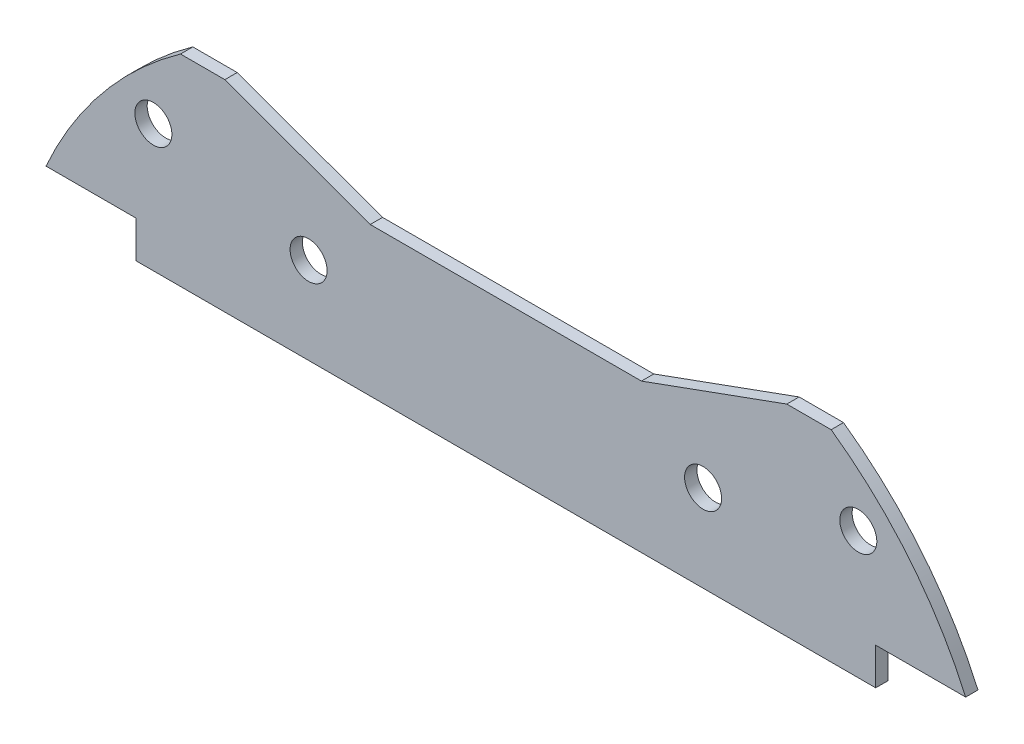
from build123d import *

# Parameters (mm, degrees)
BOSS_EXTRUDE1_DEPTH = 3
SKETCH2_R           = 1.5
CUT_EXTRUDE3_DEPTH  = 3
CUT_EXTRUDE4_START  = -10
CUT_EXTRUDE4_DEPTH  = 10
BOSS_EXTRUDE2_START = -3
BOSS_EXTRUDE2_DEPTH = 3
SKETCH5_W           = 0.56
SKETCH5_H           = 32.898596714
CUT_EXTRUDE5_DEPTH  = 3
SKETCH6_W           = 0.2
SKETCH6_H           = 32.898596714
CUT_EXTRUDE6_DEPTH  = 3
SKETCH7_R           = 2
CUT_EXTRUDE8_DEPTH  = 3
BOSS_EXTRUDE3_START = -3
BOSS_EXTRUDE3_DEPTH = 3
CUT_EXTRUDE9_START  = -3
CUT_EXTRUDE9_DEPTH  = 3
BOSS_EXTRUDE5_START = -3
BOSS_EXTRUDE5_DEPTH = 3
CUT_EXTRUDE10_START = -2
CUT_EXTRUDE10_DEPTH = 2
CUT_EXTRUDE11_START = -3
CUT_EXTRUDE11_DEPTH = 3
SKETCH13_R          = 1.5
CUT_EXTRUDE12_DEPTH = 1
SKETCH15_R          = 1.5
CUT_EXTRUDE13_DEPTH = 10


with BuildPart() as part:
    # Sketch1 → Boss-Extrude1 (new body)
    with BuildSketch(Plane.XY):
        with BuildLine():
            Line((-11, 25.5), (-22.790038711, 29.780264196))
            ThreePointArc((-22.790038711, 29.780264196), (0, -37.5), (22.790038711, 29.780264196))
            Line((22.790038711, 29.780264196), (11, 25.5))
            Line((11, 25.5), (-11, 25.5))
        make_face()
    extrude(amount=BOSS_EXTRUDE1_DEPTH)

    # Sketch2 → Cut-Extrude3 (cut)
    with BuildSketch(Plane.XY.offset(3)):
        with Locations((-25.400000001, 10.496905453)):
            Circle(SKETCH2_R)
        with Locations((-25.399981845, -10.493094547)):
            Circle(SKETCH2_R)
        with Locations(Location((25.399981845, -10.493094547, 0), (0, 0, 180))):
            Circle(SKETCH2_R)
        with Locations(Location((25.400000001, 10.496905453, 0), (0, 0, 180))):
            Circle(SKETCH2_R)
    extrude(amount=-CUT_EXTRUDE3_DEPTH, mode=Mode.SUBTRACT)

    # Sketch3 → Cut-Extrude4 (cut)
    with BuildSketch(Plane.XY.offset(3).offset(CUT_EXTRUDE4_START)):
        with BuildLine():
            Line((-30.76, 21.449298357), (-30.76, -21.449298357))
            ThreePointArc((-30.76, -21.449298357), (-37.5, 0), (-30.76, 21.449298357))
        make_face()
        with BuildLine():
            Line((30.76, 21.449298357), (30.76, -21.449298357))
            ThreePointArc((30.76, -21.449298357), (37.5, 0), (30.76, 21.449298357))
        make_face()
    extrude(amount=CUT_EXTRUDE4_DEPTH, mode=Mode.SUBTRACT)

    # Sketch4 → Boss-Extrude2 (add)
    with BuildSketch(Plane.XY.offset(3).offset(BOSS_EXTRUDE2_START)):
        with BuildLine():
            Line((-30.76, -21.449298357), (-30.76, -16.449298357))
            Line((-30.76, -16.449298357), (-33.699711921, -16.449298357))
            ThreePointArc((-33.699711921, -16.449298357), (-32.32667034, -19.006219634), (-30.76, -21.449298357))
        make_face()
        with BuildLine():
            Line((-33.699711921, 16.449298357), (-30.76, 16.449298357))
            Line((-30.76, 16.449298357), (-30.76, 21.449298357))
            ThreePointArc((-30.76, 21.449298357), (-32.32667034, 19.006219634), (-33.699711921, 16.449298357))
        make_face()
        with BuildLine():
            Line((30.76, 21.449298357), (30.76, 16.449298357))
            Line((30.76, 16.449298357), (33.699711921, 16.449298357))
            ThreePointArc((33.699711921, 16.449298357), (32.32667034, 19.006219634), (30.76, 21.449298357))
        make_face()
        with BuildLine():
            Line((30.76, -16.449298357), (30.76, -21.449298357))
            ThreePointArc((30.76, -21.449298357), (32.32667034, -19.006219634), (33.699711921, -16.449298357))
            Line((33.699711921, -16.449298357), (30.76, -16.449298357))
        make_face()
    extrude(amount=BOSS_EXTRUDE2_DEPTH)

    # Sketch5 → Cut-Extrude5 (cut)
    with BuildSketch(Plane.XY.offset(3)):
        with Locations((-30.48, 0)):
            Rectangle(SKETCH5_W, SKETCH5_H)
        with Locations((30.48, 0)):
            Rectangle(SKETCH5_W, SKETCH5_H)
    extrude(amount=-CUT_EXTRUDE5_DEPTH, mode=Mode.SUBTRACT)

    # Sketch6 → Cut-Extrude6 (cut)
    with BuildSketch(Plane.XY.offset(3)):
        with Locations((-30.1, 0)):
            Rectangle(SKETCH6_W, SKETCH6_H)
        with Locations((30.1, 0)):
            Rectangle(SKETCH6_W, SKETCH6_H)
    extrude(amount=-CUT_EXTRUDE6_DEPTH, mode=Mode.SUBTRACT)

    # Sketch7 → Cut-Extrude8 (cut)
    with BuildSketch(Plane.XY.offset(3)):
        with Locations((-19.15, -21.55)):
            Circle(SKETCH7_R)
        with Locations(Location((19.15, -21.55, 0), (0, 0, 180))):
            Circle(SKETCH7_R)
    extrude(amount=-CUT_EXTRUDE8_DEPTH, mode=Mode.SUBTRACT)

    # Sketch8 → Boss-Extrude3 (add)
    with BuildSketch(Plane.XY.offset(3).offset(BOSS_EXTRUDE3_START)):
        with BuildLine():
            Line((-33.699711921, 16.449298357), (-37.299711921, 16.449298357))
            ThreePointArc((-37.299711921, 16.449298357), (-32.744884003, 23.851322108), (-26.390038711, 29.780264196))
            Line((-26.390038711, 29.780264196), (-22.790038711, 29.780264196))
            ThreePointArc((-22.790038711, 29.780264196), (-29.020710607, 23.749702226), (-33.699711921, 16.449298357))
        make_face()
        with BuildLine():
            Line((33.699711921, 16.449298357), (37.299711921, 16.449298357))
            ThreePointArc((37.299711921, 16.449298357), (32.744884003, 23.851322108), (26.390038711, 29.780264196))
            Line((26.390038711, 29.780264196), (22.790038711, 29.780264196))
            ThreePointArc((22.790038711, 29.780264196), (29.020710607, 23.749702226), (33.699711921, 16.449298357))
        make_face()
    extrude(amount=BOSS_EXTRUDE3_DEPTH)

    # Sketch9 → Cut-Extrude9 (cut)
    with BuildSketch(Plane.XY.offset(3).offset(CUT_EXTRUDE9_START)):
        with BuildLine():
            Line((4.733920151, -37.2), (-4.733920151, -37.2))
            ThreePointArc((-4.733920151, -37.2), (0, -37.5), (4.733920151, -37.2))
        make_face()
    extrude(amount=CUT_EXTRUDE9_DEPTH, mode=Mode.SUBTRACT)

    # Sketch10 → Boss-Extrude5 (add)
    with BuildSketch(Plane.XY.offset(3).offset(BOSS_EXTRUDE5_START)):
        with BuildLine():
            ThreePointArc((-4.733920151, -37.2), (-21.838816892, -30.484685938), (-33.699711921, -16.449298357))
            Line((-33.699711921, -16.449298357), (-37.299711921, -16.449298357))
            ThreePointArc((-37.299711921, -16.449298357), (-23.43831182, -30.624902723), (-4.733920151, -37.2))
        make_face()
        with BuildLine():
            ThreePointArc((33.699711921, -16.449298357), (21.838816892, -30.484685938), (4.733920151, -37.2))
            ThreePointArc((4.733920151, -37.2), (23.43831182, -30.624902723), (37.299711921, -16.449298357))
            Line((37.299711921, -16.449298357), (33.699711921, -16.449298357))
        make_face()
        with BuildLine():
            Line((4.733920151, -37.2), (-4.733920151, -37.2))
            ThreePointArc((-4.733920151, -37.2), (0, -37.457659609), (4.733920151, -37.2))
        make_face()
    extrude(amount=BOSS_EXTRUDE5_DEPTH)

    # Sketch11 → Cut-Extrude10 (cut)
    with BuildSketch(Plane.XY.offset(3).offset(CUT_EXTRUDE10_START)):
        with BuildLine():
            Line((-30, 16.449298357), (-30, 13.449298357))
            Line((-30, 13.449298357), (30, 13.449298357))
            Line((30, 13.449298357), (30, 16.449298357))
            Line((30, 16.449298357), (37.299711921, 16.449298357))
            ThreePointArc((37.299711921, 16.449298357), (32.744884003, 23.851322108), (26.390038711, 29.780264196))
            Line((26.390038711, 29.780264196), (22.790038711, 29.780264196))
            Line((22.790038711, 29.780264196), (11, 25.5))
            Line((11, 25.5), (-11, 25.5))
            Line((-11, 25.5), (-22.790038711, 29.780264196))
            Line((-22.790038711, 29.780264196), (-26.390038711, 29.780264196))
            ThreePointArc((-26.390038711, 29.780264196), (-32.744884003, 23.851322108), (-37.299711921, 16.449298357))
            Line((-37.299711921, 16.449298357), (-30, 16.449298357))
        make_face()
    extrude(amount=CUT_EXTRUDE10_DEPTH, mode=Mode.SUBTRACT)

    # Sketch12 → Cut-Extrude11 (cut)
    with BuildSketch(Plane.XY.offset(3).offset(CUT_EXTRUDE11_START)):
        with BuildLine():
            Line((-30, 13.449298357), (-30, -16.449298357))
            Line((-30, -16.449298357), (-37.299711921, -16.449298357))
            ThreePointArc((-37.299711921, -16.449298357), (0, -37.457659609), (37.299711921, -16.449298357))
            Line((37.299711921, -16.449298357), (30, -16.449298357))
            Line((30, -16.449298357), (30, 13.449298357))
            Line((30, 13.449298357), (-30, 13.449298357))
        make_face()
    extrude(amount=CUT_EXTRUDE11_DEPTH, mode=Mode.SUBTRACT)

    # Sketch13 → Cut-Extrude12 (cut)
    with BuildSketch(Plane.XY.offset(1)):
        with Locations((-28.590038711, 23.780264196)):
            Circle(SKETCH13_R)
        with Locations(Location((28.590038711, 23.780264196, 0), (0, 0, 180))):
            Circle(SKETCH13_R)
    extrude(amount=-CUT_EXTRUDE12_DEPTH, mode=Mode.SUBTRACT)

    # Sketch15 → Cut-Extrude13 (cut)
    with BuildSketch(Plane(origin=(0, 0, 0), x_dir=(-1, 0, 0), z_dir=(0, 0, -1))):
        with Locations((-16, 20.5)):
            Circle(SKETCH15_R)
        with Locations((16, 20.5)):
            Circle(SKETCH15_R)
    extrude(amount=-CUT_EXTRUDE13_DEPTH, mode=Mode.SUBTRACT)


solid = part.part
